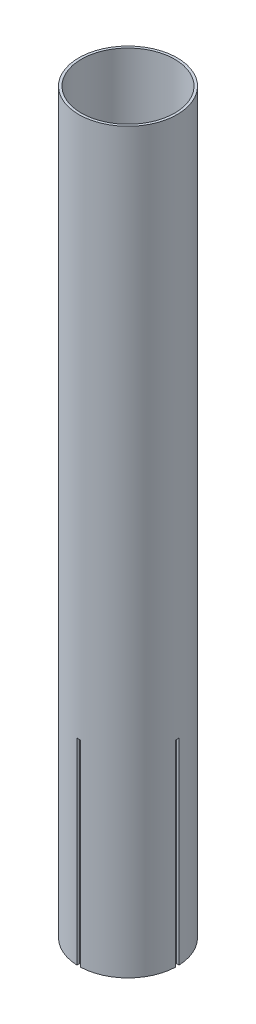
from build123d import *

# Parameters (mm, degrees)
SKETCH1_R           = 40
SKETCH1_R_2         = 38
BOSS_EXTRUDE1_DEPTH = 600
SKETCH2_W           = 3
SKETCH2_H           = 160
CUT_EXTRUDE1_DEPTH  = 603.660766933
CIRPATTERN1_COUNT   = 4


with BuildPart() as part:
    # Sketch1 → Boss-Extrude1 (new body)
    with BuildSketch(Plane(origin=(0, 0, 0), x_dir=(1, 0, 0), z_dir=(0, 1, 0))):
        with Locations(Location((0, 0, 0), (0, 0, 270))):
            Circle(SKETCH1_R)
        with Locations(Location((0, 0, 0), (0, 0, 270))):
            Circle(SKETCH1_R_2, mode=Mode.SUBTRACT)
    extrude(amount=BOSS_EXTRUDE1_DEPTH)

    # Sketch2 → Cut-Extrude1 (cut, through all)
    with BuildSketch(Plane(origin=(0, 0, 0), x_dir=(0, 0, -1), z_dir=(1, 0, 0))):
        with Locations((0, 80)):
            Rectangle(SKETCH2_W, SKETCH2_H)
    cut_extrude1 = extrude(amount=-CUT_EXTRUDE1_DEPTH, mode=Mode.SUBTRACT)

    # CirPattern1: Cut-Extrude1 ×4 about axis
    cirpattern1_axis = Axis((0, 0, 0), (0, 1, 0))
    for i in range(1, CIRPATTERN1_COUNT):
        add(cut_extrude1.rotate(cirpattern1_axis, i * 360 / CIRPATTERN1_COUNT), mode=Mode.SUBTRACT)


solid = part.part
